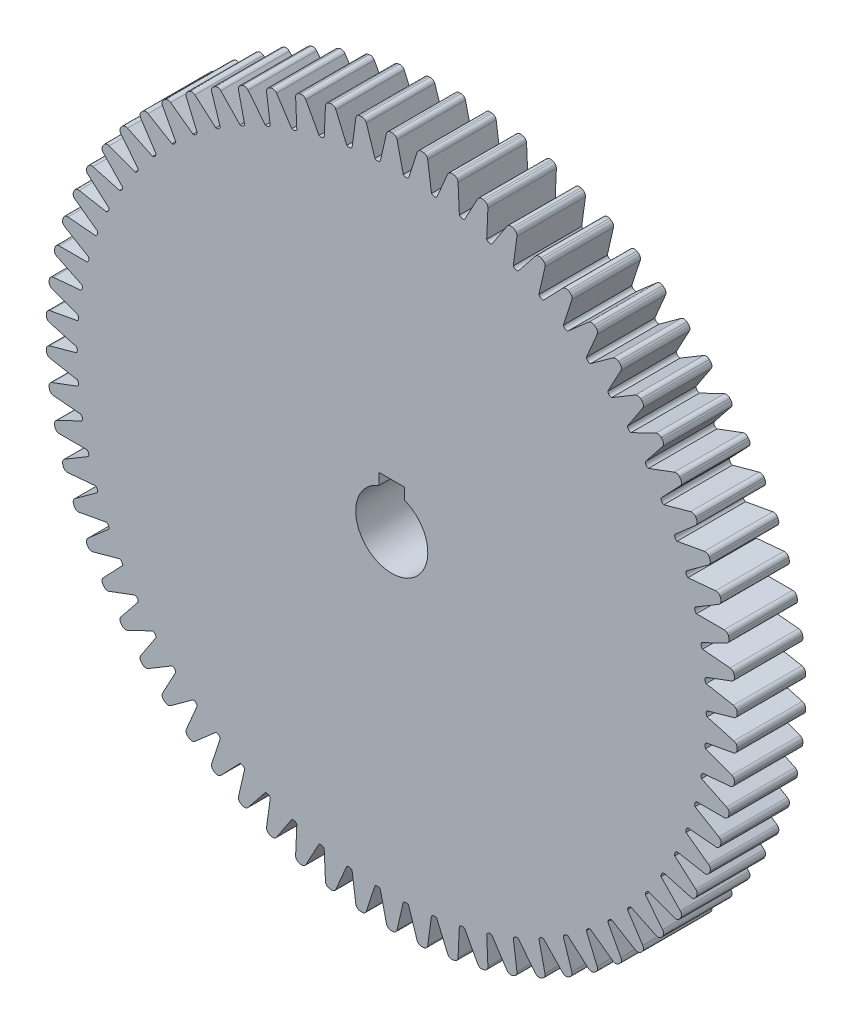
from build123d import *

# Parameters (mm, degrees)
BOSS_EXTRUDE1_DEPTH = 7.6
CUT_EXTRUDE2_DEPTH  = 55.762670703


with BuildPart() as part:
    # Sketch1 → Boss-Extrude1 (new body)
    with BuildSketch(Plane.XY):
        with BuildLine():
            Line((-0.101559752, 38.365120126), (0.101559752, 38.365120126))
            ThreePointArc((0.101559752, 38.365120126), (0.413162919, 38.256148854), (0.588942912, 37.976733991))
            Line((0.588942912, 37.976733991), (1.275962124, 34.976733991))
            add(Edge.make_bspline(
                [(1.275962124, 34.976733991), (1.560126329, 34.76012552), (1.864464787, 34.950304306)],
                knots=[0, 0, 0, 1, 1, 1], degree=2))
            Line((1.864464787, 34.950304306), (2.817636188, 37.87664326))
            ThreePointArc((2.817636188, 37.87664326), (3.017755098, 38.139176484), (3.337871952, 38.219777177))
            Line((3.337871952, 38.219777177), (3.540173756, 38.201569685))
            ThreePointArc((3.540173756, 38.201569685), (3.840754391, 38.065105207), (3.99078019, 37.771058389))
            Line((3.99078019, 37.771058389), (4.406115738, 34.72155158))
            add(Edge.make_bspline(
                [(4.406115738, 34.72155158), (4.669719348, 34.480342828), (4.989880124, 34.642475321)],
                knots=[0, 0, 0, 1, 1, 1], degree=2))
            Line((4.989880124, 34.642475321), (6.201529339, 37.471592069))
            ThreePointArc((6.201529339, 37.471592069), (6.424375926, 37.715129891), (6.750429074, 37.766711056))
            Line((6.750429074, 37.766711056), (6.950284363, 37.730442668))
            ThreePointArc((6.950284363, 37.730442668), (7.237422367, 37.567583715), (7.360486053, 37.261272434))
            Line((7.360486053, 37.261272434), (7.500793899, 34.186811651))
            add(Edge.make_bspline(
                [(7.500793899, 34.186811651), (7.741714532, 33.92294469), (8.07511988, 34.055725494)],
                knots=[0, 0, 0, 1, 1, 1], degree=2))
            Line((8.07511988, 34.055725494), (9.535491421, 36.764841652))
            ThreePointArc((9.535491421, 36.764841652), (9.779271456, 36.987423248), (10.108635709, 37.009569583))
            Line((10.108635709, 37.009569583), (10.304435367, 36.955532311))
            ThreePointArc((10.304435367, 36.955532311), (10.575818874, 36.767590129), (10.67092961, 36.451480623))
            Line((10.67092961, 36.451480623), (10.535080078, 33.376819617))
            add(Edge.make_bspline(
                [(10.535080078, 33.376819617), (10.751377984, 33.092418947), (11.095343519, 33.19477899)],
                knots=[0, 0, 0, 1, 1, 1], degree=2))
            Line((11.095343519, 33.19477899), (12.792679334, 35.762082347))
            ThreePointArc((12.792679334, 35.762082347), (13.055430042, 35.961915621), (13.385453554, 35.954448818))
            Line((13.385453554, 35.954448818), (13.575621116, 35.883077738))
            ThreePointArc((13.575621116, 35.883077738), (13.829065105, 35.671565526), (13.895457116, 35.348202923))
            Line((13.895457116, 35.348202923), (13.484543987, 32.298097056))
            add(Edge.make_bspline(
                [(13.484543987, 32.298097056), (13.674477661, 31.995452505), (14.026233976, 32.066567644)],
                knots=[0, 0, 0, 1, 1, 1], degree=2))
            Line((14.026233976, 32.066567644), (15.946868115, 34.471387783))
            ThreePointArc((15.946868115, 34.471387783), (16.226473982, 34.646863795), (16.554499597, 34.609843971))
            Line((16.554499597, 34.609843971), (16.737503946, 34.521713722))
            ThreePointArc((16.737503946, 34.521713722), (16.970967836, 34.288334451), (17.008106572, 33.960322277))
            Line((17.008106572, 33.960322277), (16.325438276, 30.959329209))
            add(Edge.make_bspline(
                [(16.325438276, 30.959329209), (16.487478485, 30.640877493), (16.844193444, 30.68017515)],
                knots=[0, 0, 0, 1, 1, 1], degree=2))
            Line((16.844193444, 30.68017515), (18.97266209, 32.903149873))
            ThreePointArc((18.97266209, 32.903149873), (19.266871894, 33.052855794), (19.590258544, 32.986581012))
            Line((19.590258544, 32.986581012), (19.764626236, 32.882401165))
            ThreePointArc((19.764626236, 32.882401165), (19.976230313, 32.629033869), (19.983816755, 32.299013085))
            Line((19.983816755, 32.299013085), (19.034889736, 29.371295047))
            add(Edge.make_bspline(
                [(19.034889736, 29.371295047), (19.167731826, 29.039600151), (19.526533371, 29.046763925)],
                knots=[0, 0, 0, 1, 1, 1], degree=2))
            Line((19.526533371, 29.046763925), (21.845699345, 31.069995148))
            ThreePointArc((21.845699345, 31.069995148), (22.152144283, 31.192725633), (22.468288247, 31.097729497))
            Line((22.468288247, 31.097729497), (22.632615377, 30.978338849))
            ThreePointArc((22.632615377, 30.978338849), (22.820655929, 30.707023492), (22.798628995, 30.377651231))
            Line((22.798628995, 30.377651231), (21.591083456, 27.546780487))
            add(Edge.make_bspline(
                [(21.591083456, 27.546780487), (21.693657862, 27.204513024), (22.051657132, 27.179485237)],
                knots=[0, 0, 0, 1, 1, 1], degree=2))
            Line((22.051657132, 27.179485237), (24.542847875, 28.98668309))
            ThreePointArc((24.542847875, 28.98668309), (24.859060631, 29.081449985), (25.165416505, 28.95849735))
            Line((25.165416505, 28.95849735), (25.318380007, 28.824857163))
            ThreePointArc((25.318380007, 28.824857163), (25.481343041, 28.537778217), (25.429880079, 28.211706391))
            Line((25.429880079, 28.211706391), (23.973438467, 25.500475448))
            add(Edge.make_bspline(
                [(23.973438467, 25.500475448), (24.04491932, 25.150391155), (24.399233917, 25.093373314)],
                knots=[0, 0, 0, 1, 1, 1], degree=2))
            Line((24.399233917, 25.093373314), (27.042391824, 26.669987303))
            ThreePointArc((27.042391824, 26.669987303), (27.36582644, 26.736027603), (27.659927626, 26.58610841))
            Line((27.659927626, 26.58610841), (27.800295928, 26.439294676))
            ThreePointArc((27.800295928, 26.439294676), (27.936869363, 26.138763531), (27.856384722, 25.81861748))
            Line((27.856384722, 25.81861748), (26.162773447, 23.248855575))
            add(Edge.make_bspline(
                [(26.162773447, 23.248855575), (26.202585225, 22.893773124), (26.550362416, 22.805224305)],
                knots=[0, 0, 0, 1, 1, 1], degree=2))
            Line((26.550362416, 22.805224305), (29.324206336, 24.138560461))
            ThreePointArc((29.324206336, 24.138560461), (29.652258706, 24.175342446), (29.931737274, 23.999663757))
            Line((29.931737274, 23.999663757), (30.058380212, 23.840858534))
            ThreePointArc((30.058380212, 23.840858534), (30.167464438, 23.529294892), (30.058606135, 23.217652241))
            Line((30.058606135, 23.217652241), (28.14146116, 20.810049587))
            add(Edge.make_bspline(
                [(28.14146116, 20.810049587), (28.149283321, 20.452827893), (28.487723009, 20.333461038)],
                knots=[0, 0, 0, 1, 1, 1], degree=2))
            Line((28.487723009, 20.333461038), (31.36991958, 21.412784123))
            ThreePointArc((31.36991958, 21.412784123), (31.699948419, 21.420011647), (31.962554172, 21.219987923))
            Line((31.962554172, 21.219987923), (32.074452093, 21.050469818))
            ThreePointArc((32.074452093, 21.050469818), (32.155168829, 20.730382204), (32.018813325, 20.429752118))
            Line((32.018813325, 20.429752118), (29.893570374, 18.203693315))
            add(Edge.make_bspline(
                [(29.893570374, 18.203693315), (29.86933994, 17.847208517), (30.195717206, 17.697984699)],
                knots=[0, 0, 0, 1, 1, 1], degree=2))
            Line((30.195717206, 17.697984699), (33.163060677, 18.514604638))
            ThreePointArc((33.163060677, 18.514604638), (33.492408787, 18.492219509), (33.736027378, 18.269461223))
            Line((33.736027378, 18.269461223), (33.832279346, 18.090595096))
            ThreePointArc((33.832279346, 18.090595096), (33.883978707, 17.764560669), (33.721223857, 17.477363644))
            Line((33.721223857, 17.477363644), (31.404994136, 15.450771609))
            add(Edge.make_bspline(
                [(31.404994136, 15.450771609), (31.348906196, 15.097893913), (31.660593243, 14.920014594)],
                knots=[0, 0, 0, 1, 1, 1], degree=2))
            Line((31.660593243, 14.920014594), (34.689192309, 15.467356443))
            ThreePointArc((34.689192309, 15.467356443), (35.015207973, 15.415538893), (35.237877928, 15.171839564))
            Line((35.237877928, 15.171839564), (35.317708978, 14.98506554))
            ThreePointArc((35.317708978, 14.98506554), (35.339974711, 14.655709336), (35.152130922, 14.384257715))
            Line((35.152130922, 14.384257715), (32.663563352, 12.573449374))
            add(Edge.make_bspline(
                [(32.663563352, 12.573449374), (32.576069493, 12.227019945), (32.8705568, 12.021917303)],
                knots=[0, 0, 0, 1, 1, 1], degree=2))
            Line((32.8705568, 12.021917303), (35.936026961, 12.295574188))
            ThreePointArc((35.936026961, 12.295574188), (36.256085293, 12.214741421), (36.456013805, 11.952063174))
            Line((36.456013805, 11.952063174), (36.518781183, 11.758885047))
            ThreePointArc((36.518781183, 11.758885047), (36.511434019, 11.428858849), (36.300013698, 11.1753382))
            Line((36.300013698, 11.1753382), (33.659144761, 9.594893118))
            add(Edge.make_bspline(
                [(33.659144761, 9.594893118), (33.540949432, 9.257701201), (33.815865961, 9.027026604)],
                knots=[0, 0, 0, 1, 1, 1], degree=2))
            Line((33.815865961, 9.027026604), (36.893525854, 9.0247952))
            ThreePointArc((36.893525854, 9.0247952), (37.205049932, 8.915598034), (37.380627294, 8.636055798))
            Line((37.380627294, 8.636055798), (37.425825636, 8.438028925))
            ThreePointArc((37.425825636, 8.438028925), (37.388924729, 8.109989911), (37.155630108, 7.876441433))
            Line((37.155630108, 7.876441433), (34.383722528, 6.539084425))
            add(Edge.make_bspline(
                [(34.383722528, 6.539084425), (34.235777368, 6.213844891), (34.488909653, 5.959455594)],
                knots=[0, 0, 0, 1, 1, 1], degree=2))
            Line((34.488909653, 5.959455594), (37.55397977, 5.681353867))
            ThreePointArc((37.55397977, 5.681353867), (37.854461385, 5.544671494), (38.004273952, 5.25051598))
            Line((38.004273952, 5.25051598), (38.031539346, 5.049234756))
            ThreePointArc((38.031539346, 5.049234756), (37.965381801, 4.725824102), (37.712091231, 4.51412819))
            Line((37.712091231, 4.51412819), (34.831462778, 3.430626868))
            add(Edge.make_bspline(
                [(34.831462778, 3.430626868), (34.654958955, 3.119958355), (34.884268923, 2.843902552)],
                knots=[0, 0, 0, 1, 1, 1], degree=2))
            Line((34.884268923, 2.843902552), (37.912071123, 2.292169614))
            ThreePointArc((37.912071123, 2.292169614), (38.199090973, 2.129102519), (38.321932542, 1.822702094))
            Line((38.321932542, 1.822702094), (38.331045464, 1.619787118))
            ThreePointArc((38.331045464, 1.619787118), (38.236163942, 1.303608737), (37.96491677, 1.115469842))
            Line((37.96491677, 1.115469842), (34.998760571, 0.294547922))
            add(Edge.make_bspline(
                [(34.998760571, 0.294547922), (34.795119189, 0.000951749), (34.998760571, -0.294547922)],
                knots=[0, 0, 0, 1, 1, 1], degree=2))
            Line((34.998760571, -0.294547922), (37.96491677, -1.115469842))
            ThreePointArc((37.96491677, -1.115469842), (38.236163942, -1.303608737), (38.331045464, -1.619787118))
            Line((38.331045464, -1.619787118), (38.321932542, -1.822702094))
            ThreePointArc((38.321932542, -1.822702094), (38.199090973, -2.129102519), (37.912071123, -2.292169614))
            Line((37.912071123, -2.292169614), (34.884268923, -2.843902552))
            add(Edge.make_bspline(
                [(34.884268923, -2.843902552), (34.655129583, -3.11806252), (34.831462778, -3.430626868)],
                knots=[0, 0, 0, 1, 1, 1], degree=2))
            Line((34.831462778, -3.430626868), (37.712091231, -4.51412819))
            ThreePointArc((37.712091231, -4.51412819), (37.965381801, -4.725824102), (38.031539346, -5.049234756))
            Line((38.031539346, -5.049234756), (38.004273952, -5.25051598))
            ThreePointArc((38.004273952, -5.25051598), (37.854461385, -5.544671494), (37.55397977, -5.681353867))
            Line((37.55397977, -5.681353867), (34.488909653, -5.959455594))
            add(Edge.make_bspline(
                [(34.488909653, -5.959455594), (34.236117251, -6.211971982), (34.383722528, -6.539084425)],
                knots=[0, 0, 0, 1, 1, 1], degree=2))
            Line((34.383722528, -6.539084425), (37.155630108, -7.876441433))
            ThreePointArc((37.155630108, -7.876441433), (37.388924729, -8.109989911), (37.425825636, -8.438028925))
            Line((37.425825636, -8.438028925), (37.380627294, -8.636055798))
            ThreePointArc((37.380627294, -8.636055798), (37.205049932, -8.915598034), (36.893525854, -9.0247952))
            Line((36.893525854, -9.0247952), (33.815865961, -9.027026604))
            add(Edge.make_bspline(
                [(33.815865961, -9.027026604), (33.541455832, -9.255866299), (33.659144761, -9.594893118)],
                knots=[0, 0, 0, 1, 1, 1], degree=2))
            Line((33.659144761, -9.594893118), (36.300013698, -11.1753382))
            ThreePointArc((36.300013698, -11.1753382), (36.511434019, -11.428858849), (36.518781183, -11.758885047))
            Line((36.518781183, -11.758885047), (36.456013805, -11.952063174))
            ThreePointArc((36.456013805, -11.952063174), (36.256085293, -12.214741421), (35.936026961, -12.295574188))
            Line((35.936026961, -12.295574188), (32.8705568, -12.021917303))
            add(Edge.make_bspline(
                [(32.8705568, -12.021917303), (32.576738334, -12.225237823), (32.663563352, -12.573449374)],
                knots=[0, 0, 0, 1, 1, 1], degree=2))
            Line((32.663563352, -12.573449374), (35.152130922, -14.384257715))
            ThreePointArc((35.152130922, -14.384257715), (35.339974711, -14.655709336), (35.317708978, -14.98506554))
            Line((35.317708978, -14.98506554), (35.237877928, -15.171839564))
            ThreePointArc((35.237877928, -15.171839564), (35.015207973, -15.415538893), (34.689192309, -15.467356443))
            Line((34.689192309, -15.467356443), (31.660593243, -14.920014594))
            add(Edge.make_bspline(
                [(31.660593243, -14.920014594), (31.349732093, -15.096178921), (31.404994136, -15.450771609)],
                knots=[0, 0, 0, 1, 1, 1], degree=2))
            Line((31.404994136, -15.450771609), (33.721223857, -17.477363644))
            ThreePointArc((33.721223857, -17.477363644), (33.883978707, -17.764560669), (33.832279346, -18.090595096))
            Line((33.832279346, -18.090595096), (33.736027378, -18.269461223))
            ThreePointArc((33.736027378, -18.269461223), (33.492408787, -18.492219509), (33.163060677, -18.514604638))
            Line((33.163060677, -18.514604638), (30.195717206, -17.697984699))
            add(Edge.make_bspline(
                [(30.195717206, -17.697984699), (29.870316243, -17.845574462), (29.893570374, -18.203693315)],
                knots=[0, 0, 0, 1, 1, 1], degree=2))
            Line((29.893570374, -18.203693315), (32.018813325, -20.429752118))
            ThreePointArc((32.018813325, -20.429752118), (32.155168829, -20.730382204), (32.074452093, -21.050469818))
            Line((32.074452093, -21.050469818), (31.962554172, -21.219987923))
            ThreePointArc((31.962554172, -21.219987923), (31.699948419, -21.420011647), (31.36991958, -21.412784123))
            Line((31.36991958, -21.412784123), (28.487723009, -20.333461038))
            add(Edge.make_bspline(
                [(28.487723009, -20.333461038), (28.15040217, -20.45128793), (28.14146116, -20.810049587)],
                knots=[0, 0, 0, 1, 1, 1], degree=2))
            Line((28.14146116, -20.810049587), (30.058606135, -23.217652241))
            ThreePointArc((30.058606135, -23.217652241), (30.167464438, -23.529294892), (30.058380212, -23.840858534))
            Line((30.058380212, -23.840858534), (29.931737274, -23.999663757))
            ThreePointArc((29.931737274, -23.999663757), (29.652258706, -24.175342446), (29.324206336, -24.138560461))
            Line((29.324206336, -24.138560461), (26.550362416, -22.805224305))
            add(Edge.make_bspline(
                [(26.550362416, -22.805224305), (26.20383761, -22.892339653), (26.162773447, -23.248855575)],
                knots=[0, 0, 0, 1, 1, 1], degree=2))
            Line((26.162773447, -23.248855575), (27.856384722, -25.81861748))
            ThreePointArc((27.856384722, -25.81861748), (27.936869363, -26.138763531), (27.800295928, -26.439294676))
            Line((27.800295928, -26.439294676), (27.659927626, -26.58610841))
            ThreePointArc((27.659927626, -26.58610841), (27.36582644, -26.736027603), (27.042391824, -26.669987303))
            Line((27.042391824, -26.669987303), (24.399233917, -25.093373314))
            add(Edge.make_bspline(
                [(24.399233917, -25.093373314), (24.046295158, -25.149075718), (23.973438467, -25.500475448)],
                knots=[0, 0, 0, 1, 1, 1], degree=2))
            Line((23.973438467, -25.500475448), (25.429880079, -28.211706391))
            ThreePointArc((25.429880079, -28.211706391), (25.481343041, -28.537778217), (25.318380007, -28.824857163))
            Line((25.318380007, -28.824857163), (25.165416505, -28.95849735))
            ThreePointArc((25.165416505, -28.95849735), (24.859060631, -29.081449985), (24.542847875, -28.98668309))
            Line((24.542847875, -28.98668309), (22.051657132, -27.179485237))
            add(Edge.make_bspline(
                [(22.051657132, -27.179485237), (21.695146077, -27.203326213), (21.591083456, -27.546780487)],
                knots=[0, 0, 0, 1, 1, 1], degree=2))
            Line((21.591083456, -27.546780487), (22.798628995, -30.377651231))
            ThreePointArc((22.798628995, -30.377651231), (22.820655929, -30.707023492), (22.632615377, -30.978338849))
            Line((22.632615377, -30.978338849), (22.468288247, -31.097729497))
            ThreePointArc((22.468288247, -31.097729497), (22.152144283, -31.192725633), (21.845699345, -31.069995148))
            Line((21.845699345, -31.069995148), (19.526533371, -29.046763925))
            add(Edge.make_bspline(
                [(19.526533371, -29.046763925), (19.169320435, -29.03855152), (19.034889736, -29.371295047)],
                knots=[0, 0, 0, 1, 1, 1], degree=2))
            Line((19.034889736, -29.371295047), (19.983816755, -32.299013085))
            ThreePointArc((19.983816755, -32.299013085), (19.976230313, -32.629033869), (19.764626236, -32.882401165))
            Line((19.764626236, -32.882401165), (19.590258544, -32.986581012))
            ThreePointArc((19.590258544, -32.986581012), (19.266871894, -33.052855794), (18.97266209, -32.903149873))
            Line((18.97266209, -32.903149873), (16.844193444, -30.68017515))
            add(Edge.make_bspline(
                [(16.844193444, -30.68017515), (16.489154697, -30.639975485), (16.325438276, -30.959329209)],
                knots=[0, 0, 0, 1, 1, 1], degree=2))
            Line((16.325438276, -30.959329209), (17.008106572, -33.960322277))
            ThreePointArc((17.008106572, -33.960322277), (16.970967836, -34.288334451), (16.737503946, -34.521713722))
            Line((16.737503946, -34.521713722), (16.554499597, -34.609843971))
            ThreePointArc((16.554499597, -34.609843971), (16.226473982, -34.646863795), (15.946868115, -34.471387783))
            Line((15.946868115, -34.471387783), (14.026233976, -32.066567644))
            add(Edge.make_bspline(
                [(14.026233976, -32.066567644), (13.676227981, -31.994704383), (13.484543987, -32.298097056)],
                knots=[0, 0, 0, 1, 1, 1], degree=2))
            Line((13.484543987, -32.298097056), (13.895457116, -35.348202923))
            ThreePointArc((13.895457116, -35.348202923), (13.829065105, -35.671565526), (13.575621116, -35.883077738))
            Line((13.575621116, -35.883077738), (13.385453554, -35.954448818))
            ThreePointArc((13.385453554, -35.954448818), (13.055430042, -35.961915621), (12.792679334, -35.762082347))
            Line((12.792679334, -35.762082347), (11.095343519, -33.19477899))
            add(Edge.make_bspline(
                [(11.095343519, -33.19477899), (10.753188318, -33.091830734), (10.535080078, -33.376819617)],
                knots=[0, 0, 0, 1, 1, 1], degree=2))
            Line((10.535080078, -33.376819617), (10.67092961, -36.451480623))
            ThreePointArc((10.67092961, -36.451480623), (10.575818874, -36.767590129), (10.304435367, -36.955532311))
            Line((10.304435367, -36.955532311), (10.108635709, -37.009569583))
            ThreePointArc((10.108635709, -37.009569583), (9.779271456, -36.987423248), (9.535491421, -36.764841652))
            Line((9.535491421, -36.764841652), (8.07511988, -34.055725494))
            add(Edge.make_bspline(
                [(8.07511988, -34.055725494), (7.743570306, -33.922521121), (7.500793899, -34.186811651)],
                knots=[0, 0, 0, 1, 1, 1], degree=2))
            Line((7.500793899, -34.186811651), (7.360486053, -37.261272434))
            ThreePointArc((7.360486053, -37.261272434), (7.237422367, -37.567583715), (6.950284363, -37.730442668))
            Line((6.950284363, -37.730442668), (6.750429074, -37.766711056))
            ThreePointArc((6.750429074, -37.766711056), (6.424375926, -37.715129891), (6.201529339, -37.471592069))
            Line((6.201529339, -37.471592069), (4.989880124, -34.642475321))
            add(Edge.make_bspline(
                [(4.989880124, -34.642475321), (4.671605619, -34.480087315), (4.406115738, -34.72155158)],
                knots=[0, 0, 0, 1, 1, 1], degree=2))
            Line((4.406115738, -34.72155158), (3.99078019, -37.771058389))
            ThreePointArc((3.99078019, -37.771058389), (3.840754391, -38.065105207), (3.540173756, -38.201569685))
            Line((3.540173756, -38.201569685), (3.337871952, -38.219777177))
            ThreePointArc((3.337871952, -38.219777177), (3.017755098, -38.139176484), (2.817636188, -37.87664326))
            Line((2.817636188, -37.87664326), (1.864464787, -34.950304306))
            add(Edge.make_bspline(
                [(1.864464787, -34.950304306), (1.56202791, -34.76004012), (1.275962124, -34.976733991)],
                knots=[0, 0, 0, 1, 1, 1], degree=2))
            Line((1.275962124, -34.976733991), (0.588942912, -37.976733991))
            ThreePointArc((0.588942912, -37.976733991), (0.413162919, -38.256148854), (0.101559752, -38.365120126))
            Line((0.101559752, -38.365120126), (-0.101559752, -38.365120126))
            ThreePointArc((-0.101559752, -38.365120126), (-0.413162919, -38.256148854), (-0.588942912, -37.976733991))
            Line((-0.588942912, -37.976733991), (-1.275962124, -34.976733991))
            add(Edge.make_bspline(
                [(-1.275962124, -34.976733991), (-1.560126329, -34.76012552), (-1.864464787, -34.950304306)],
                knots=[0, 0, 0, 1, 1, 1], degree=2))
            Line((-1.864464787, -34.950304306), (-2.817636188, -37.87664326))
            ThreePointArc((-2.817636188, -37.87664326), (-3.017755098, -38.139176484), (-3.337871952, -38.219777177))
            Line((-3.337871952, -38.219777177), (-3.540173756, -38.201569685))
            ThreePointArc((-3.540173756, -38.201569685), (-3.840754391, -38.065105207), (-3.99078019, -37.771058389))
            Line((-3.99078019, -37.771058389), (-4.406115738, -34.72155158))
            add(Edge.make_bspline(
                [(-4.406115738, -34.72155158), (-4.669719348, -34.480342828), (-4.989880124, -34.642475321)],
                knots=[0, 0, 0, 1, 1, 1], degree=2))
            Line((-4.989880124, -34.642475321), (-6.201529339, -37.471592069))
            ThreePointArc((-6.201529339, -37.471592069), (-6.424375926, -37.715129891), (-6.750429074, -37.766711056))
            Line((-6.750429074, -37.766711056), (-6.950284363, -37.730442668))
            ThreePointArc((-6.950284363, -37.730442668), (-7.237422367, -37.567583715), (-7.360486053, -37.261272434))
            Line((-7.360486053, -37.261272434), (-7.500793899, -34.186811651))
            add(Edge.make_bspline(
                [(-7.500793899, -34.186811651), (-7.741714532, -33.92294469), (-8.07511988, -34.055725494)],
                knots=[0, 0, 0, 1, 1, 1], degree=2))
            Line((-8.07511988, -34.055725494), (-9.535491421, -36.764841652))
            ThreePointArc((-9.535491421, -36.764841652), (-9.779271456, -36.987423248), (-10.108635709, -37.009569583))
            Line((-10.108635709, -37.009569583), (-10.304435367, -36.955532311))
            ThreePointArc((-10.304435367, -36.955532311), (-10.575818874, -36.767590129), (-10.67092961, -36.451480623))
            Line((-10.67092961, -36.451480623), (-10.535080078, -33.376819617))
            add(Edge.make_bspline(
                [(-10.535080078, -33.376819617), (-10.751377984, -33.092418947), (-11.095343519, -33.19477899)],
                knots=[0, 0, 0, 1, 1, 1], degree=2))
            Line((-11.095343519, -33.19477899), (-12.792679334, -35.762082347))
            ThreePointArc((-12.792679334, -35.762082347), (-13.055430042, -35.961915621), (-13.385453554, -35.954448818))
            Line((-13.385453554, -35.954448818), (-13.575621116, -35.883077738))
            ThreePointArc((-13.575621116, -35.883077738), (-13.829065105, -35.671565526), (-13.895457116, -35.348202923))
            Line((-13.895457116, -35.348202923), (-13.484543987, -32.298097056))
            add(Edge.make_bspline(
                [(-13.484543987, -32.298097056), (-13.674477661, -31.995452505), (-14.026233976, -32.066567644)],
                knots=[0, 0, 0, 1, 1, 1], degree=2))
            Line((-14.026233976, -32.066567644), (-15.946868115, -34.471387783))
            ThreePointArc((-15.946868115, -34.471387783), (-16.226473982, -34.646863795), (-16.554499597, -34.609843971))
            Line((-16.554499597, -34.609843971), (-16.737503946, -34.521713722))
            ThreePointArc((-16.737503946, -34.521713722), (-16.970967836, -34.288334451), (-17.008106572, -33.960322277))
            Line((-17.008106572, -33.960322277), (-16.325438276, -30.959329209))
            add(Edge.make_bspline(
                [(-16.325438276, -30.959329209), (-16.487478485, -30.640877493), (-16.844193444, -30.68017515)],
                knots=[0, 0, 0, 1, 1, 1], degree=2))
            Line((-16.844193444, -30.68017515), (-18.97266209, -32.903149873))
            ThreePointArc((-18.97266209, -32.903149873), (-19.266871894, -33.052855794), (-19.590258544, -32.986581012))
            Line((-19.590258544, -32.986581012), (-19.764626236, -32.882401165))
            ThreePointArc((-19.764626236, -32.882401165), (-19.976230313, -32.629033869), (-19.983816755, -32.299013085))
            Line((-19.983816755, -32.299013085), (-19.034889736, -29.371295047))
            add(Edge.make_bspline(
                [(-19.034889736, -29.371295047), (-19.167731826, -29.039600151), (-19.526533371, -29.046763925)],
                knots=[0, 0, 0, 1, 1, 1], degree=2))
            Line((-19.526533371, -29.046763925), (-21.845699345, -31.069995148))
            ThreePointArc((-21.845699345, -31.069995148), (-22.152144283, -31.192725633), (-22.468288247, -31.097729497))
            Line((-22.468288247, -31.097729497), (-22.632615377, -30.978338849))
            ThreePointArc((-22.632615377, -30.978338849), (-22.820655929, -30.707023492), (-22.798628995, -30.377651231))
            Line((-22.798628995, -30.377651231), (-21.591083456, -27.546780487))
            add(Edge.make_bspline(
                [(-21.591083456, -27.546780487), (-21.693657862, -27.204513024), (-22.051657132, -27.179485237)],
                knots=[0, 0, 0, 1, 1, 1], degree=2))
            Line((-22.051657132, -27.179485237), (-24.542847875, -28.98668309))
            ThreePointArc((-24.542847875, -28.98668309), (-24.859060631, -29.081449985), (-25.165416505, -28.95849735))
            Line((-25.165416505, -28.95849735), (-25.318380007, -28.824857163))
            ThreePointArc((-25.318380007, -28.824857163), (-25.481343041, -28.537778217), (-25.429880079, -28.211706391))
            Line((-25.429880079, -28.211706391), (-23.973438467, -25.500475448))
            add(Edge.make_bspline(
                [(-23.973438467, -25.500475448), (-24.04491932, -25.150391155), (-24.399233917, -25.093373314)],
                knots=[0, 0, 0, 1, 1, 1], degree=2))
            Line((-24.399233917, -25.093373314), (-27.042391824, -26.669987303))
            ThreePointArc((-27.042391824, -26.669987303), (-27.36582644, -26.736027603), (-27.659927626, -26.58610841))
            Line((-27.659927626, -26.58610841), (-27.800295928, -26.439294676))
            ThreePointArc((-27.800295928, -26.439294676), (-27.936869363, -26.138763531), (-27.856384722, -25.81861748))
            Line((-27.856384722, -25.81861748), (-26.162773447, -23.248855575))
            add(Edge.make_bspline(
                [(-26.162773447, -23.248855575), (-26.202585225, -22.893773124), (-26.550362416, -22.805224305)],
                knots=[0, 0, 0, 1, 1, 1], degree=2))
            Line((-26.550362416, -22.805224305), (-29.324206336, -24.138560461))
            ThreePointArc((-29.324206336, -24.138560461), (-29.652258706, -24.175342446), (-29.931737274, -23.999663757))
            Line((-29.931737274, -23.999663757), (-30.058380212, -23.840858534))
            ThreePointArc((-30.058380212, -23.840858534), (-30.167464438, -23.529294892), (-30.058606135, -23.217652241))
            Line((-30.058606135, -23.217652241), (-28.14146116, -20.810049587))
            add(Edge.make_bspline(
                [(-28.14146116, -20.810049587), (-28.149283321, -20.452827893), (-28.487723009, -20.333461038)],
                knots=[0, 0, 0, 1, 1, 1], degree=2))
            Line((-28.487723009, -20.333461038), (-31.36991958, -21.412784123))
            ThreePointArc((-31.36991958, -21.412784123), (-31.699948419, -21.420011647), (-31.962554172, -21.219987923))
            Line((-31.962554172, -21.219987923), (-32.074452093, -21.050469818))
            ThreePointArc((-32.074452093, -21.050469818), (-32.155168829, -20.730382204), (-32.018813325, -20.429752118))
            Line((-32.018813325, -20.429752118), (-29.893570374, -18.203693315))
            add(Edge.make_bspline(
                [(-29.893570374, -18.203693315), (-29.86933994, -17.847208517), (-30.195717206, -17.697984699)],
                knots=[0, 0, 0, 1, 1, 1], degree=2))
            Line((-30.195717206, -17.697984699), (-33.163060677, -18.514604638))
            ThreePointArc((-33.163060677, -18.514604638), (-33.492408787, -18.492219509), (-33.736027378, -18.269461223))
            Line((-33.736027378, -18.269461223), (-33.832279346, -18.090595096))
            ThreePointArc((-33.832279346, -18.090595096), (-33.883978707, -17.764560669), (-33.721223857, -17.477363644))
            Line((-33.721223857, -17.477363644), (-31.404994136, -15.450771609))
            add(Edge.make_bspline(
                [(-31.404994136, -15.450771609), (-31.348906196, -15.097893913), (-31.660593243, -14.920014594)],
                knots=[0, 0, 0, 1, 1, 1], degree=2))
            Line((-31.660593243, -14.920014594), (-34.689192309, -15.467356443))
            ThreePointArc((-34.689192309, -15.467356443), (-35.015207973, -15.415538893), (-35.237877928, -15.171839564))
            Line((-35.237877928, -15.171839564), (-35.317708978, -14.98506554))
            ThreePointArc((-35.317708978, -14.98506554), (-35.339974711, -14.655709336), (-35.152130922, -14.384257715))
            Line((-35.152130922, -14.384257715), (-32.663563352, -12.573449374))
            add(Edge.make_bspline(
                [(-32.663563352, -12.573449374), (-32.576069493, -12.227019945), (-32.8705568, -12.021917303)],
                knots=[0, 0, 0, 1, 1, 1], degree=2))
            Line((-32.8705568, -12.021917303), (-35.936026961, -12.295574188))
            ThreePointArc((-35.936026961, -12.295574188), (-36.256085293, -12.214741421), (-36.456013805, -11.952063174))
            Line((-36.456013805, -11.952063174), (-36.518781183, -11.758885047))
            ThreePointArc((-36.518781183, -11.758885047), (-36.511434019, -11.428858849), (-36.300013698, -11.1753382))
            Line((-36.300013698, -11.1753382), (-33.659144761, -9.594893118))
            add(Edge.make_bspline(
                [(-33.659144761, -9.594893118), (-33.540949432, -9.257701201), (-33.815865961, -9.027026604)],
                knots=[0, 0, 0, 1, 1, 1], degree=2))
            Line((-33.815865961, -9.027026604), (-36.893525854, -9.0247952))
            ThreePointArc((-36.893525854, -9.0247952), (-37.205049932, -8.915598034), (-37.380627294, -8.636055798))
            Line((-37.380627294, -8.636055798), (-37.425825636, -8.438028925))
            ThreePointArc((-37.425825636, -8.438028925), (-37.388924729, -8.109989911), (-37.155630108, -7.876441433))
            Line((-37.155630108, -7.876441433), (-34.383722528, -6.539084425))
            add(Edge.make_bspline(
                [(-34.383722528, -6.539084425), (-34.235777368, -6.213844891), (-34.488909653, -5.959455594)],
                knots=[0, 0, 0, 1, 1, 1], degree=2))
            Line((-34.488909653, -5.959455594), (-37.55397977, -5.681353867))
            ThreePointArc((-37.55397977, -5.681353867), (-37.854461385, -5.544671494), (-38.004273952, -5.25051598))
            Line((-38.004273952, -5.25051598), (-38.031539346, -5.049234756))
            ThreePointArc((-38.031539346, -5.049234756), (-37.965381801, -4.725824102), (-37.712091231, -4.51412819))
            Line((-37.712091231, -4.51412819), (-34.831462778, -3.430626868))
            add(Edge.make_bspline(
                [(-34.831462778, -3.430626868), (-34.654958955, -3.119958355), (-34.884268923, -2.843902552)],
                knots=[0, 0, 0, 1, 1, 1], degree=2))
            Line((-34.884268923, -2.843902552), (-37.912071123, -2.292169614))
            ThreePointArc((-37.912071123, -2.292169614), (-38.199090973, -2.129102519), (-38.321932542, -1.822702094))
            Line((-38.321932542, -1.822702094), (-38.331045464, -1.619787118))
            ThreePointArc((-38.331045464, -1.619787118), (-38.236163942, -1.303608737), (-37.96491677, -1.115469842))
            Line((-37.96491677, -1.115469842), (-34.998760571, -0.294547922))
            add(Edge.make_bspline(
                [(-34.998760571, -0.294547922), (-34.795119189, -0.000951749), (-34.998760571, 0.294547922)],
                knots=[0, 0, 0, 1, 1, 1], degree=2))
            Line((-34.998760571, 0.294547922), (-37.96491677, 1.115469842))
            ThreePointArc((-37.96491677, 1.115469842), (-38.236163942, 1.303608737), (-38.331045464, 1.619787118))
            Line((-38.331045464, 1.619787118), (-38.321932542, 1.822702094))
            ThreePointArc((-38.321932542, 1.822702094), (-38.199090973, 2.129102519), (-37.912071123, 2.292169614))
            Line((-37.912071123, 2.292169614), (-34.884268923, 2.843902552))
            add(Edge.make_bspline(
                [(-34.884268923, 2.843902552), (-34.655129583, 3.11806252), (-34.831462778, 3.430626868)],
                knots=[0, 0, 0, 1, 1, 1], degree=2))
            Line((-34.831462778, 3.430626868), (-37.712091231, 4.51412819))
            ThreePointArc((-37.712091231, 4.51412819), (-37.965381801, 4.725824102), (-38.031539346, 5.049234756))
            Line((-38.031539346, 5.049234756), (-38.004273952, 5.25051598))
            ThreePointArc((-38.004273952, 5.25051598), (-37.854461385, 5.544671494), (-37.55397977, 5.681353867))
            Line((-37.55397977, 5.681353867), (-34.488909653, 5.959455594))
            add(Edge.make_bspline(
                [(-34.488909653, 5.959455594), (-34.236117251, 6.211971982), (-34.383722528, 6.539084425)],
                knots=[0, 0, 0, 1, 1, 1], degree=2))
            Line((-34.383722528, 6.539084425), (-37.155630108, 7.876441433))
            ThreePointArc((-37.155630108, 7.876441433), (-37.388924729, 8.109989911), (-37.425825636, 8.438028925))
            Line((-37.425825636, 8.438028925), (-37.380627294, 8.636055798))
            ThreePointArc((-37.380627294, 8.636055798), (-37.205049932, 8.915598034), (-36.893525854, 9.0247952))
            Line((-36.893525854, 9.0247952), (-33.815865961, 9.027026604))
            add(Edge.make_bspline(
                [(-33.815865961, 9.027026604), (-33.541455832, 9.255866299), (-33.659144761, 9.594893118)],
                knots=[0, 0, 0, 1, 1, 1], degree=2))
            Line((-33.659144761, 9.594893118), (-36.300013698, 11.1753382))
            ThreePointArc((-36.300013698, 11.1753382), (-36.511434019, 11.428858849), (-36.518781183, 11.758885047))
            Line((-36.518781183, 11.758885047), (-36.456013805, 11.952063174))
            ThreePointArc((-36.456013805, 11.952063174), (-36.256085293, 12.214741421), (-35.936026961, 12.295574188))
            Line((-35.936026961, 12.295574188), (-32.8705568, 12.021917303))
            add(Edge.make_bspline(
                [(-32.8705568, 12.021917303), (-32.576738334, 12.225237823), (-32.663563352, 12.573449374)],
                knots=[0, 0, 0, 1, 1, 1], degree=2))
            Line((-32.663563352, 12.573449374), (-35.152130922, 14.384257715))
            ThreePointArc((-35.152130922, 14.384257715), (-35.339974711, 14.655709336), (-35.317708978, 14.98506554))
            Line((-35.317708978, 14.98506554), (-35.237877928, 15.171839564))
            ThreePointArc((-35.237877928, 15.171839564), (-35.015207973, 15.415538893), (-34.689192309, 15.467356443))
            Line((-34.689192309, 15.467356443), (-31.660593243, 14.920014594))
            add(Edge.make_bspline(
                [(-31.660593243, 14.920014594), (-31.349732093, 15.096178921), (-31.404994136, 15.450771609)],
                knots=[0, 0, 0, 1, 1, 1], degree=2))
            Line((-31.404994136, 15.450771609), (-33.721223857, 17.477363644))
            ThreePointArc((-33.721223857, 17.477363644), (-33.883978707, 17.764560669), (-33.832279346, 18.090595096))
            Line((-33.832279346, 18.090595096), (-33.736027378, 18.269461223))
            ThreePointArc((-33.736027378, 18.269461223), (-33.492408787, 18.492219509), (-33.163060677, 18.514604638))
            Line((-33.163060677, 18.514604638), (-30.195717206, 17.697984699))
            add(Edge.make_bspline(
                [(-30.195717206, 17.697984699), (-29.870316243, 17.845574462), (-29.893570374, 18.203693315)],
                knots=[0, 0, 0, 1, 1, 1], degree=2))
            Line((-29.893570374, 18.203693315), (-32.018813325, 20.429752118))
            ThreePointArc((-32.018813325, 20.429752118), (-32.155168829, 20.730382204), (-32.074452093, 21.050469818))
            Line((-32.074452093, 21.050469818), (-31.962554172, 21.219987923))
            ThreePointArc((-31.962554172, 21.219987923), (-31.699948419, 21.420011647), (-31.36991958, 21.412784123))
            Line((-31.36991958, 21.412784123), (-28.487723009, 20.333461038))
            add(Edge.make_bspline(
                [(-28.487723009, 20.333461038), (-28.15040217, 20.45128793), (-28.14146116, 20.810049587)],
                knots=[0, 0, 0, 1, 1, 1], degree=2))
            Line((-28.14146116, 20.810049587), (-30.058606135, 23.217652241))
            ThreePointArc((-30.058606135, 23.217652241), (-30.167464438, 23.529294892), (-30.058380212, 23.840858534))
            Line((-30.058380212, 23.840858534), (-29.931737274, 23.999663757))
            ThreePointArc((-29.931737274, 23.999663757), (-29.652258706, 24.175342446), (-29.324206336, 24.138560461))
            Line((-29.324206336, 24.138560461), (-26.550362416, 22.805224305))
            add(Edge.make_bspline(
                [(-26.550362416, 22.805224305), (-26.20383761, 22.892339653), (-26.162773447, 23.248855575)],
                knots=[0, 0, 0, 1, 1, 1], degree=2))
            Line((-26.162773447, 23.248855575), (-27.856384722, 25.81861748))
            ThreePointArc((-27.856384722, 25.81861748), (-27.936869363, 26.138763531), (-27.800295928, 26.439294676))
            Line((-27.800295928, 26.439294676), (-27.659927626, 26.58610841))
            ThreePointArc((-27.659927626, 26.58610841), (-27.36582644, 26.736027603), (-27.042391824, 26.669987303))
            Line((-27.042391824, 26.669987303), (-24.399233917, 25.093373314))
            add(Edge.make_bspline(
                [(-24.399233917, 25.093373314), (-24.046295158, 25.149075718), (-23.973438467, 25.500475448)],
                knots=[0, 0, 0, 1, 1, 1], degree=2))
            Line((-23.973438467, 25.500475448), (-25.429880079, 28.211706391))
            ThreePointArc((-25.429880079, 28.211706391), (-25.481343041, 28.537778217), (-25.318380007, 28.824857163))
            Line((-25.318380007, 28.824857163), (-25.165416505, 28.95849735))
            ThreePointArc((-25.165416505, 28.95849735), (-24.859060631, 29.081449985), (-24.542847875, 28.98668309))
            Line((-24.542847875, 28.98668309), (-22.051657132, 27.179485237))
            add(Edge.make_bspline(
                [(-22.051657132, 27.179485237), (-21.695146077, 27.203326213), (-21.591083456, 27.546780487)],
                knots=[0, 0, 0, 1, 1, 1], degree=2))
            Line((-21.591083456, 27.546780487), (-22.798628995, 30.377651231))
            ThreePointArc((-22.798628995, 30.377651231), (-22.820655929, 30.707023492), (-22.632615377, 30.978338849))
            Line((-22.632615377, 30.978338849), (-22.468288247, 31.097729497))
            ThreePointArc((-22.468288247, 31.097729497), (-22.152144283, 31.192725633), (-21.845699345, 31.069995148))
            Line((-21.845699345, 31.069995148), (-19.526533371, 29.046763925))
            add(Edge.make_bspline(
                [(-19.526533371, 29.046763925), (-19.169320435, 29.03855152), (-19.034889736, 29.371295047)],
                knots=[0, 0, 0, 1, 1, 1], degree=2))
            Line((-19.034889736, 29.371295047), (-19.983816755, 32.299013085))
            ThreePointArc((-19.983816755, 32.299013085), (-19.976230313, 32.629033869), (-19.764626236, 32.882401165))
            Line((-19.764626236, 32.882401165), (-19.590258544, 32.986581012))
            ThreePointArc((-19.590258544, 32.986581012), (-19.266871894, 33.052855794), (-18.97266209, 32.903149873))
            Line((-18.97266209, 32.903149873), (-16.844193444, 30.68017515))
            add(Edge.make_bspline(
                [(-16.844193444, 30.68017515), (-16.489154697, 30.639975485), (-16.325438276, 30.959329209)],
                knots=[0, 0, 0, 1, 1, 1], degree=2))
            Line((-16.325438276, 30.959329209), (-17.008106572, 33.960322277))
            ThreePointArc((-17.008106572, 33.960322277), (-16.970967836, 34.288334451), (-16.737503946, 34.521713722))
            Line((-16.737503946, 34.521713722), (-16.554499597, 34.609843971))
            ThreePointArc((-16.554499597, 34.609843971), (-16.226473982, 34.646863795), (-15.946868115, 34.471387783))
            Line((-15.946868115, 34.471387783), (-14.026233976, 32.066567644))
            add(Edge.make_bspline(
                [(-14.026233976, 32.066567644), (-13.676227981, 31.994704383), (-13.484543987, 32.298097056)],
                knots=[0, 0, 0, 1, 1, 1], degree=2))
            Line((-13.484543987, 32.298097056), (-13.895457116, 35.348202923))
            ThreePointArc((-13.895457116, 35.348202923), (-13.829065105, 35.671565526), (-13.575621116, 35.883077738))
            Line((-13.575621116, 35.883077738), (-13.385453554, 35.954448818))
            ThreePointArc((-13.385453554, 35.954448818), (-13.055430042, 35.961915621), (-12.792679334, 35.762082347))
            Line((-12.792679334, 35.762082347), (-11.095343519, 33.19477899))
            add(Edge.make_bspline(
                [(-11.095343519, 33.19477899), (-10.753188318, 33.091830734), (-10.535080078, 33.376819617)],
                knots=[0, 0, 0, 1, 1, 1], degree=2))
            Line((-10.535080078, 33.376819617), (-10.67092961, 36.451480623))
            ThreePointArc((-10.67092961, 36.451480623), (-10.575818874, 36.767590129), (-10.304435367, 36.955532311))
            Line((-10.304435367, 36.955532311), (-10.108635709, 37.009569583))
            ThreePointArc((-10.108635709, 37.009569583), (-9.779271456, 36.987423248), (-9.535491421, 36.764841652))
            Line((-9.535491421, 36.764841652), (-8.07511988, 34.055725494))
            add(Edge.make_bspline(
                [(-8.07511988, 34.055725494), (-7.743570306, 33.922521121), (-7.500793899, 34.186811651)],
                knots=[0, 0, 0, 1, 1, 1], degree=2))
            Line((-7.500793899, 34.186811651), (-7.360486053, 37.261272434))
            ThreePointArc((-7.360486053, 37.261272434), (-7.237422367, 37.567583715), (-6.950284363, 37.730442668))
            Line((-6.950284363, 37.730442668), (-6.750429074, 37.766711056))
            ThreePointArc((-6.750429074, 37.766711056), (-6.424375926, 37.715129891), (-6.201529339, 37.471592069))
            Line((-6.201529339, 37.471592069), (-4.989880124, 34.642475321))
            add(Edge.make_bspline(
                [(-4.989880124, 34.642475321), (-4.671605619, 34.480087315), (-4.406115738, 34.72155158)],
                knots=[0, 0, 0, 1, 1, 1], degree=2))
            Line((-4.406115738, 34.72155158), (-3.99078019, 37.771058389))
            ThreePointArc((-3.99078019, 37.771058389), (-3.840754391, 38.065105207), (-3.540173756, 38.201569685))
            Line((-3.540173756, 38.201569685), (-3.337871952, 38.219777177))
            ThreePointArc((-3.337871952, 38.219777177), (-3.017755098, 38.139176484), (-2.817636188, 37.87664326))
            Line((-2.817636188, 37.87664326), (-1.864464787, 34.950304306))
            add(Edge.make_bspline(
                [(-1.864464787, 34.950304306), (-1.56202791, 34.76004012), (-1.275962124, 34.976733991)],
                knots=[0, 0, 0, 1, 1, 1], degree=2))
            Line((-1.275962124, 34.976733991), (-0.588942912, 37.976733991))
            ThreePointArc((-0.588942912, 37.976733991), (-0.413162919, 38.256148854), (-0.101559752, 38.365120126))
        make_face()
    extrude(amount=BOSS_EXTRUDE1_DEPTH)

    # Sketch5 → Cut-Extrude2 (cut, through all)
    with BuildSketch(Plane(origin=(0, 0, 0), x_dir=(-1, 0, 0), z_dir=(0, 0, -1))):
        with BuildLine():
            Line((-1.431631359, 3.735027664), (-1.431631359, 5))
            Line((-1.431631359, 5), (1.431631359, 5))
            Line((1.431631359, 5), (1.431631359, 3.735027664))
            ThreePointArc((1.431631359, 3.735027664), (0, -4), (-1.431631359, 3.735027664))
        make_face()
    extrude(amount=-CUT_EXTRUDE2_DEPTH, mode=Mode.SUBTRACT)


solid = part.part
